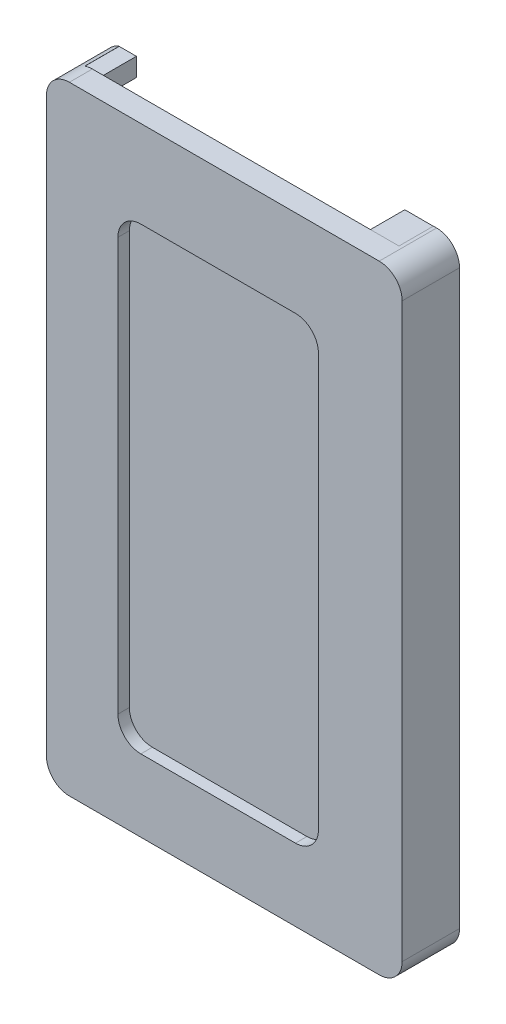
from build123d import *

# Parameters (mm, degrees)
SKETCH_5_W          = 31
SKETCH_5_H          = 53.868777402
SKETCH_5_W_2        = 27.381586342
SKETCH_5_H_2        = 50.42341648
EXTRUDE_3_DEPTH     = 3
SKETCH_8_W          = 15
SKETCH_8_H          = 1.581115617
CUT_EXTRUDE_6_DEPTH = 1
SKETCH_9_W          = 31
SKETCH_9_H          = 53.868777402
EXTRUDE_5_DEPTH     = 2
SKETCH_10_W         = 17.475002228
SKETCH_10_H         = 39.986467982
CUT_EXTRUDE_7_DEPTH = 1
FILLET_1_R          = 2
FILLET_2_R          = 2
SKETCH_11_W         = 27.381586342
SKETCH_11_H         = 3
CUT_EXTRUDE_8_DEPTH = 2
SKETCH_14_W         = 2.490628955
SKETCH_14_H         = 1.721797648
SKETCH_14_W_2       = 1.5
SKETCH_14_H_2       = 1.606542801
EXTRUDE_6_DEPTH     = 3


with BuildPart() as part:
    # 草图5 → 凸台-拉伸3 (new body)
    with BuildSketch(Plane.XY.offset(15)):
        with Locations((52.576231829, -51.822040042)):
            Rectangle(SKETCH_5_W, SKETCH_5_H)
        with Locations((52.104679946, -51.963604886)):
            Rectangle(SKETCH_5_W_2, SKETCH_5_H_2, mode=Mode.SUBTRACT)
    extrude(amount=EXTRUDE_3_DEPTH)

    # 草图8 → 切除-拉伸6 (cut)
    with BuildSketch(Plane(origin=(0, 0, 15), x_dir=(-1, 0, 0), z_dir=(0, 0, -1))):
        with Locations((-47.690080224, -77.965870935)):
            Rectangle(SKETCH_8_W, SKETCH_8_H)
    extrude(amount=-CUT_EXTRUDE_6_DEPTH, mode=Mode.SUBTRACT)

    # 草图9 → 凸台-拉伸5 (add)
    with BuildSketch(Plane.XY.offset(18)):
        with Locations((52.576231829, -51.822040042)):
            Rectangle(SKETCH_9_W, SKETCH_9_H)
    extrude(amount=EXTRUDE_5_DEPTH)

    # 草图10 → 切除-拉伸7 (cut)
    with BuildSketch(Plane.XY.offset(20)):
        with Locations((52.039568352, -52.470675496)):
            Rectangle(SKETCH_10_W, SKETCH_10_H)
    extrude(amount=-CUT_EXTRUDE_7_DEPTH, mode=Mode.SUBTRACT)

    # 圆角1
    fillet_1_edges = [part.edges().sort_by_distance(p)[0] for p in [
        (37.076231829, -78.756428743, 17.5),
        (37.076231829, -24.887651341, 17.5),
        (68.076231829, -24.887651341, 17.5),
        (68.076231829, -78.756428743, 17.5),
    ]]
    fillet(fillet_1_edges, radius=FILLET_1_R)

    # 圆角2
    fillet_2_edges = [part.edges().sort_by_distance(p)[0] for p in [
        (43.302067238, -72.463909487, 19.5),
        (43.302067238, -32.477441505, 19.5),
        (60.777069466, -32.477441505, 19.5),
        (60.777069466, -72.463909487, 19.5),
    ]]
    fillet(fillet_2_edges, radius=FILLET_2_R)

    # 草图11 → 切除-拉伸8 (cut)
    with BuildSketch(Plane(origin=(0, -26.751896646, 0), x_dir=(-1, 0, 0), z_dir=(0, -1, 0))):
        with Locations((-52.104679946, -16.5)):
            Rectangle(SKETCH_11_W, SKETCH_11_H)
    extrude(amount=-CUT_EXTRUDE_8_DEPTH, mode=Mode.SUBTRACT)

    # 草图14 → 凸台-拉伸6 (add)
    with BuildSketch(Plane(origin=(0, 0, 18), x_dir=(-1, 0, 0), z_dir=(0, 0, -1))):
        with Locations((-64.550158639, -25.755243126)):
            Rectangle(SKETCH_14_W, SKETCH_14_H)
        with Locations((-39.163886775, -25.81287055)):
            Rectangle(SKETCH_14_W_2, SKETCH_14_H_2)
    extrude(amount=EXTRUDE_6_DEPTH)


solid = part.part
